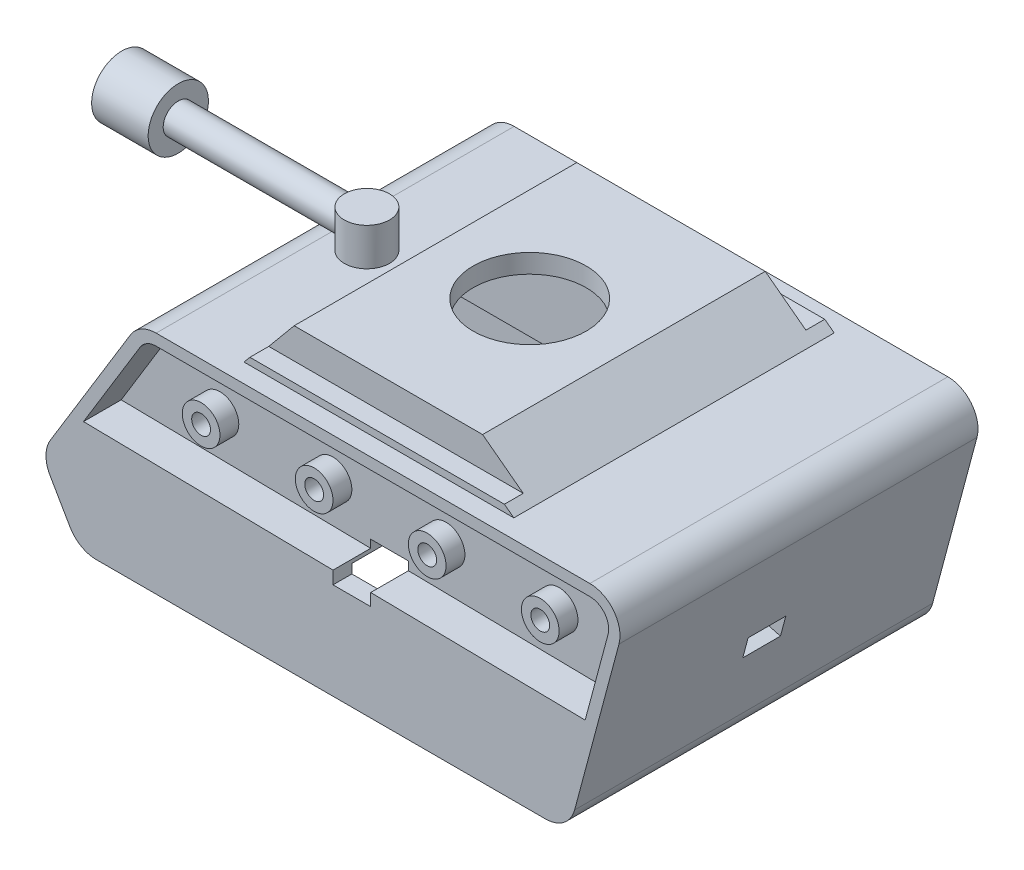
from build123d import *

# Parameters (mm, degrees)
SALIENTE_EXTRUIR2_DEPTH  = 75
CORTAR_EXTRUIR1_DEPTH    = 32.5
CROQUIS3_W               = 110
CROQUIS3_H               = 65
CORTAR_EXTRUIR2_DEPTH    = 55
CORTAR_EXTRUIR2_DRAFT    = -7
CROQUIS4_R               = 15
CORTAR_EXTRUIR3_DEPTH    = 55
CROQUIS5_R               = 5
CROQUIS5_R_2             = 2.5
SALIENTE_EXTRUIR3_DEPTH  = 5
CROQUIS5_3_R             = 5
CROQUIS5_3_R_2           = 2.5
SALIENTE_EXTRUIR4_DEPTH  = 5
SALIENTE_EXTRUIR5_START  = 5
CROQUIS6_R               = 5
CROQUIS6_R_2             = 2.500392092
CROQUIS6_R_3             = 2.5
SALIENTE_EXTRUIR5_DEPTH  = 5
SALIENTE_EXTRUIR6_DEPTH  = 10
SALIENTE_EXTRUIR7_START  = 10
SALIENTE_EXTRUIR7_DEPTH  = 10
CROQUIS9_R               = 6
SALIENTE_EXTRUIR8_DEPTH  = 10
CROQUIS10_R              = 4
SALIENTE_EXTRUIR9_DEPTH  = 50
CROQUIS11_R              = 8
CROQUIS11_R_2            = 4
SALIENTE_EXTRUIR10_DEPTH = 15
CROQUIS13_W              = 10
CROQUIS13_H              = 5.5
CORTAR_EXTRUIR4_DEPTH    = 150.747299501
CROQUIS14_W              = 10
CROQUIS14_H              = 5.5
CORTAR_EXTRUIR5_DEPTH    = 10
CROQUIS15_W              = 10
CROQUIS15_H              = 5.5
CORTAR_EXTRUIR6_DEPTH    = 10
CORTAR_EXTRUIR8_START    = -10
CORTAR_EXTRUIR8_DEPTH    = 10
CORTAR_EXTRUIR9_DEPTH    = 10


with BuildPart() as part:
    # Croquis1 → Saliente-Extruir2 (new body)
    with BuildSketch(Plane.XY):
        with BuildLine():
            ThreePointArc((75.985648559, 52.638141098), (82.331351573, 49.509696626), (83.714009708, 42.571154413))
            Line((83.714009708, 42.571154413), (71.94600193, -1.428845587))
            ThreePointArc((71.94600193, -1.428845587), (69.089196309, -5.707561916), (64.217640781, -7.361858902))
            Line((64.217640781, -7.361858902), (-55.022008345, -7.361858902))
            ThreePointArc((-55.022008345, -7.361858902), (-59.022008345, -6.290062133), (-61.950211576, -3.361858902))
            Line((-61.950211576, -3.361858902), (-67.265987011, 5.845334234))
            ThreePointArc((-67.265987011, 5.845334234), (-68.337190395, 9.94277051), (-67.166502489, 14.012899568))
            Line((-67.166502489, 14.012899568), (-45.932461091, 48.805706431))
            ThreePointArc((-45.932461091, 48.805706431), (-43.0190634, 51.614548578), (-39.103742383, 52.638141098))
            Line((-39.103742383, 52.638141098), (75.985648559, 52.638141098))
        make_face()
        Polygon((-12.478128479, 62.638141098), (-20.784752342, 52.638141098), (50.8195562, 52.638141098), (37.521871521, 62.638141098), align=None)
    extrude(amount=-SALIENTE_EXTRUIR2_DEPTH)

    # Croquis2 → Cortar-Extruir1 (cut, symmetric)
    with BuildSketch(Plane.XY.offset(-37.5)):
        with BuildLine():
            Line((75.985648559, 47.638141098), (49.149317794, 47.638141098))
            Line((49.149317794, 47.638141098), (35.851633115, 57.638141098))
            Line((35.851633115, 57.638141098), (-10.13144041, 57.638141098))
            Line((-10.13144041, 57.638141098), (-18.438064273, 47.638141098))
            Line((-18.438064273, 47.638141098), (-39.103742383, 47.638141098))
            ThreePointArc((-39.103742383, 47.638141098), (-40.571987765, 47.254293903), (-41.664511899, 46.200978098))
            Line((-41.664511899, 46.200978098), (-62.898553296, 11.408171234))
            ThreePointArc((-62.898553296, 11.408171234), (-63.337561261, 9.881872837), (-62.935859992, 8.345334234))
            Line((-62.935859992, 8.345334234), (-57.620084557, -0.861858902))
            ThreePointArc((-57.620084557, -0.861858902), (-56.522008345, -1.959935114), (-55.022008345, -2.361858902))
            Line((-55.022008345, -2.361858902), (64.217640781, -2.361858902))
            ThreePointArc((64.217640781, -2.361858902), (66.044474104, -1.741497532), (67.115776212, -0.136978909))
            Line((67.115776212, -0.136978909), (78.88378399, 43.863021091))
            ThreePointArc((78.88378399, 43.863021091), (78.365287189, 46.464974421), (75.985648559, 47.638141098))
        make_face()
    extrude(amount=CORTAR_EXTRUIR1_DEPTH, both=True, mode=Mode.SUBTRACT)


with BuildPart() as cortar_extruir2_tool:
    # Croquis3 → Cortar-Extruir2 (with draft: the straight prism first)
    with BuildSketch(Plane.XZ.offset(7.361858902)):
        with Locations((4.977991655, -37.5)):
            Rectangle(CROQUIS3_W, CROQUIS3_H)
    extrude(amount=-CORTAR_EXTRUIR2_DEPTH)
    # Cortar-Extruir2: the draft: its side faces are tilted about the plane it starts from
    cortar_extruir2_sides = [cortar_extruir2_tool.faces().sort_by_distance(p)[0] for p in [
        (-50.022008345, 20.138141098, -37.5),
        (4.977991655, 20.138141098, -70),
        (59.977991655, 20.138141098, -37.5),
        (4.977991655, 20.138141098, -5),
    ]]
    draft(cortar_extruir2_sides, Plane.XZ.offset(7.361858902), CORTAR_EXTRUIR2_DRAFT)


with BuildPart() as part_1:
    add(part.part)

    # Cortar-Extruir2: cut by cortar_extruir2_tool
    add(cortar_extruir2_tool.part, mode=Mode.SUBTRACT)

    # Croquis4 → Cortar-Extruir3 (cut)
    with BuildSketch(Plane(origin=(0, 62.638141098, 0), x_dir=(1, 0, 0), z_dir=(0, 1, 0))):
        with Locations(Location((12.521871521, 37.5, 0), (0, 0, 270))):
            Circle(CROQUIS4_R)
    extrude(amount=-CORTAR_EXTRUIR3_DEPTH, mode=Mode.SUBTRACT)

    # Croquis5 → Saliente-Extruir3 (add)
    # profile 1 of 4: a face of its own
    with BuildSketch(Plane.XY):
        with Locations((57.830005819, 32.638141098)):
            Circle(CROQUIS5_R)
        with Locations((57.830005819, 32.638141098)):
            Circle(CROQUIS5_R_2, mode=Mode.SUBTRACT)
    # profile 2 of 4: a face of its own
    with BuildSketch(Plane.XY):
        with Locations((27.830005819, 32.638141098)):
            Circle(CROQUIS5_R)
        with Locations((27.830005819, 32.638141098)):
            Circle(CROQUIS5_R_2, mode=Mode.SUBTRACT)
    # profile 3 of 4: a face of its own
    with BuildSketch(Plane.XY):
        with Locations((-2.169994181, 32.638141098)):
            Circle(CROQUIS5_R)
        with Locations((-2.169994181, 32.638141098)):
            Circle(CROQUIS5_R_2, mode=Mode.SUBTRACT)
    # profile 4 of 4: a face of its own
    with BuildSketch(Plane.XY):
        with Locations((-32.169994181, 32.638141098)):
            Circle(CROQUIS5_R)
        with Locations((-32.169994181, 32.638141098)):
            Circle(CROQUIS5_R_2, mode=Mode.SUBTRACT)
    extrude(amount=SALIENTE_EXTRUIR3_DEPTH)

    # Croquis5<3> → Saliente-Extruir4 (add)
    # profile 1 of 5: a face of its own
    with BuildSketch(Plane.XY):
        with Locations((57.830005819, 32.638141098)):
            Circle(CROQUIS5_3_R)
        with Locations((57.830005819, 32.638141098)):
            Circle(CROQUIS5_3_R_2, mode=Mode.SUBTRACT)
    # profile 2 of 5: a face of its own
    with BuildSketch(Plane.XY):
        with Locations((27.830005819, 32.638141098)):
            Circle(CROQUIS5_3_R)
        with Locations((27.830005819, 32.638141098)):
            Circle(CROQUIS5_3_R_2, mode=Mode.SUBTRACT)
    # profile 3 of 5: a face of its own
    with BuildSketch(Plane.XY):
        with Locations((-2.169994181, 32.638141098)):
            Circle(CROQUIS5_3_R)
        with Locations((-2.169994181, 32.638141098)):
            Circle(CROQUIS5_3_R_2, mode=Mode.SUBTRACT)
    # profile 4 of 5: a face of its own
    with BuildSketch(Plane.XY):
        with Locations((-32.169994181, 32.638141098)):
            Circle(CROQUIS5_3_R)
        with Locations((-32.169994181, 32.638141098)):
            Circle(CROQUIS5_3_R_2, mode=Mode.SUBTRACT)
    # profile 5 of 5: a face of its own
    with BuildSketch(Plane.XY):
        Polygon((-20.784752342, 52.638141098), (50.8195562, 52.638141098), (48.316992723, 54.520095391), (-19.221483697, 54.520095391), align=None)
    extrude(amount=SALIENTE_EXTRUIR4_DEPTH)

    # Croquis6 → Saliente-Extruir5 (add)
    # profile 1 of 5: a face of its own
    with BuildSketch(Plane(origin=(0, 0, -75), x_dir=(-1, 0, 0), z_dir=(0, 0, -1)).offset(SALIENTE_EXTRUIR5_START)):
        with Locations(Location((-57.830005819, 32.638141098, 0), (0, 0, 180))):
            Circle(CROQUIS6_R)
        with Locations((-57.830005819, 32.638141098)):
            Circle(CROQUIS6_R_2, mode=Mode.SUBTRACT)
    # profile 2 of 5: a face of its own
    with BuildSketch(Plane(origin=(0, 0, -75), x_dir=(-1, 0, 0), z_dir=(0, 0, -1)).offset(SALIENTE_EXTRUIR5_START)):
        with Locations(Location((-27.830005819, 32.638141098, 0), (0, 0, 180))):
            Circle(CROQUIS6_R)
        with Locations(Location((-27.830005819, 32.638141098, 0), (0, 0, 180))):
            Circle(CROQUIS6_R_3, mode=Mode.SUBTRACT)
    # profile 3 of 5: a face of its own
    with BuildSketch(Plane(origin=(0, 0, -75), x_dir=(-1, 0, 0), z_dir=(0, 0, -1)).offset(SALIENTE_EXTRUIR5_START)):
        with Locations(Location((2.169994181, 32.638141098, 0), (0, 0, 180))):
            Circle(CROQUIS6_R)
        with Locations(Location((2.169994181, 32.638141098, 0), (0, 0, 180))):
            Circle(CROQUIS6_R_3, mode=Mode.SUBTRACT)
    # profile 4 of 5: a face of its own
    with BuildSketch(Plane(origin=(0, 0, -75), x_dir=(-1, 0, 0), z_dir=(0, 0, -1)).offset(SALIENTE_EXTRUIR5_START)):
        with Locations(Location((32.169994181, 32.638141098, 0), (0, 0, 180))):
            Circle(CROQUIS6_R)
        with Locations(Location((32.169994181, 32.638141098, 0), (0, 0, 180))):
            Circle(CROQUIS6_R_3, mode=Mode.SUBTRACT)
    # profile 5 of 5: a face of its own
    with BuildSketch(Plane(origin=(0, 0, -75), x_dir=(-1, 0, 0), z_dir=(0, 0, -1)).offset(SALIENTE_EXTRUIR5_START)):
        Polygon((-50.8195562, 52.638141098), (20.784752342, 52.638141098), (19.221483697, 54.520095391), (-48.316992723, 54.520095391), align=None)
    extrude(amount=-SALIENTE_EXTRUIR5_DEPTH)

    # Croquis7 → Saliente-Extruir6 (add)
    with BuildSketch(Plane(origin=(0, 0, -75), x_dir=(-1, 0, 0), z_dir=(0, 0, -1))):
        with BuildLine():
            Line((-64.217640781, -7.361858902), (55.022008345, -7.361858902))
            ThreePointArc((55.022008345, -7.361858902), (59.022008345, -6.290062133), (61.950211576, -3.361858902))
            Line((61.950211576, -3.361858902), (67.265987011, 5.845334234))
            ThreePointArc((67.265987011, 5.845334234), (68.337190395, 9.94277051), (67.166502489, 14.012899568))
            Line((67.166502489, 14.012899568), (45.932461091, 48.805706431))
            ThreePointArc((45.932461091, 48.805706431), (43.0190634, 51.614548578), (39.103742383, 52.638141098))
            Line((39.103742383, 52.638141098), (-75.985648559, 52.638141098))
            ThreePointArc((-75.985648559, 52.638141098), (-82.331351573, 49.509696626), (-83.714009708, 42.571154413))
            Line((-83.714009708, 42.571154413), (-71.94600193, -1.428845587))
            ThreePointArc((-71.94600193, -1.428845587), (-69.089196309, -5.707561916), (-64.217640781, -7.361858902))
        make_face()
        with BuildLine():
            Line((-80.815874277, 43.34627442), (-75.750475658, 24.406999103))
            Line((-75.750475658, 24.406999103), (57.308417572, 24.406999103))
            Line((57.308417572, 24.406999103), (43.371691576, 47.242869431))
            ThreePointArc((43.371691576, 47.242869431), (41.550818019, 48.998395773), (39.103742383, 49.638141098))
            Line((39.103742383, 49.638141098), (-75.985648559, 49.638141098))
            ThreePointArc((-75.985648559, 49.638141098), (-79.951712943, 47.682863303), (-80.815874277, 43.34627442))
        make_face(mode=Mode.SUBTRACT)
    extrude(amount=SALIENTE_EXTRUIR6_DEPTH)

    # Croquis8 → Saliente-Extruir7 (add)
    with BuildSketch(Plane.XY.offset(SALIENTE_EXTRUIR7_START)):
        with BuildLine():
            Line((-67.265987011, 5.845334234), (-61.950211576, -3.361858902))
            ThreePointArc((-61.950211576, -3.361858902), (-59.022008345, -6.290062133), (-55.022008345, -7.361858902))
            Line((-55.022008345, -7.361858902), (64.217640781, -7.361858902))
            ThreePointArc((64.217640781, -7.361858902), (69.089196309, -5.707561916), (71.94600193, -1.428845587))
            Line((71.94600193, -1.428845587), (77.830005819, 20.571154413))
            Line((77.830005819, 20.571154413), (83.714009708, 42.571154413))
            ThreePointArc((83.714009708, 42.571154413), (82.331351573, 49.509696626), (75.985648559, 52.638141098))
            Line((75.985648559, 52.638141098), (-39.103742383, 52.638141098))
            ThreePointArc((-39.103742383, 52.638141098), (-43.0190634, 51.614548578), (-45.932461091, 48.805706431))
            Line((-45.932461091, 48.805706431), (-61.857992139, 22.711101283))
            Line((-61.857992139, 22.711101283), (-67.166502489, 14.012899568))
            ThreePointArc((-67.166502489, 14.012899568), (-68.337190395, 9.94277051), (-67.265987011, 5.845334234))
        make_face()
        with BuildLine():
            Line((74.737232796, 20.618534074), (-58.375978579, 22.657758662))
            Line((-58.375978579, 22.657758662), (-43.371691576, 47.242869431))
            ThreePointArc((-43.371691576, 47.242869431), (-41.550818019, 48.998395773), (-39.103742383, 49.638141098))
            Line((-39.103742383, 49.638141098), (75.985648559, 49.638141098))
            ThreePointArc((75.985648559, 49.638141098), (79.951712943, 47.682863303), (80.815874277, 43.34627442))
            Line((80.815874277, 43.34627442), (74.931870388, 21.34627442))
            Line((74.931870388, 21.34627442), (74.737232796, 20.618534074))
        make_face(mode=Mode.SUBTRACT)
    extrude(amount=-SALIENTE_EXTRUIR7_DEPTH)

    # Croquis9 → Saliente-Extruir8 (add)
    with BuildSketch(Plane(origin=(0, 52.638141098, 0), x_dir=(1, 0, 0), z_dir=(0, 1, 0))):
        with Locations(Location((-30.145674551, 36.966662757, 0), (0, 0, 90))):
            Circle(CROQUIS9_R)
    extrude(amount=SALIENTE_EXTRUIR8_DEPTH)

    # Croquis10 → Saliente-Extruir9 (add)
    with BuildSketch(Plane(origin=(-30, 0, 0), x_dir=(0, 0, -1), z_dir=(1, 0, 0))):
        with Locations((36.77409929, 58.138141098)):
            Circle(CROQUIS10_R)
    extrude(amount=-SALIENTE_EXTRUIR9_DEPTH)

    # Croquis13 → Cortar-Extruir4 (cut, through all)
    with BuildSketch(Plane(origin=(0, 0, -85), x_dir=(-1, 0, 0), z_dir=(0, 0, -1))):
        with Locations((-12.830005819, 20.998141098)):
            Rectangle(CROQUIS13_W, CROQUIS13_H)
    extrude(amount=-CORTAR_EXTRUIR4_DEPTH, mode=Mode.SUBTRACT)

    # Croquis14 → Cortar-Extruir5 (cut)
    with BuildSketch(Plane(origin=(67.499758765, -18.053129231, 0), x_dir=(0, 0, -1), z_dir=(0.9660451436025732, -0.25837333554738934, 0))):
        with Locations((35, 37.830238009)):
            Rectangle(CROQUIS14_W, CROQUIS14_H)
    extrude(amount=-CORTAR_EXTRUIR5_DEPTH, mode=Mode.SUBTRACT)

    # Croquis15 → Cortar-Extruir6 (cut)
    with BuildSketch(Plane(origin=(-55.169733428, 33.670074625, 0), x_dir=(0, 0, 1), z_dir=(-0.8535898384862245, 0.5209456666803759, 0))):
        with Locations((-40, -15.018261496)):
            Rectangle(CROQUIS15_W, CROQUIS15_H)
    extrude(amount=-CORTAR_EXTRUIR6_DEPTH, mode=Mode.SUBTRACT)

    # Croquis16 → Cortar-Extruir8 (cut)
    with BuildSketch(Plane(origin=(0, 0, -5), x_dir=(-1, 0, 0), z_dir=(0, 0, -1)).offset(CORTAR_EXTRUIR8_START)):
        with BuildLine():
            Line((62.898553296, 11.408171234), (56.601326318, 21.726423795))
            Line((56.601326318, 21.726423795), (-7.830005819, 20.658584157))
            Line((-7.830005819, 20.658584157), (-7.830005819, 18.248141098))
            Line((-7.830005819, 18.248141098), (-17.830005819, 18.248141098))
            Line((-17.830005819, 18.248141098), (-17.830005819, 20.492851181))
            Line((-17.830005819, 20.492851181), (-72.391472167, 19.588587765))
            Line((-72.391472167, 19.588587765), (-67.115776212, -0.136978909))
            ThreePointArc((-67.115776212, -0.136978909), (-66.044474104, -1.741497532), (-64.217640781, -2.361858902))
            Line((-64.217640781, -2.361858902), (55.022008345, -2.361858902))
            ThreePointArc((55.022008345, -2.361858902), (56.522008345, -1.959935114), (57.620084557, -0.861858902))
            Line((57.620084557, -0.861858902), (62.935859992, 8.345334234))
            ThreePointArc((62.935859992, 8.345334234), (63.337561261, 9.881872837), (62.898553296, 11.408171234))
        make_face()
    extrude(amount=CORTAR_EXTRUIR8_DEPTH, mode=Mode.SUBTRACT)

    # Croquis18 → Cortar-Extruir9 (cut)
    with BuildSketch(Plane.XY.offset(-70)):
        with BuildLine():
            Line((-64.605732973, 12.450062567), (-59.139316828, 21.406999103))
            Line((-59.139316828, 21.406999103), (-57.308417572, 21.406999103))
            Line((-57.308417572, 21.406999103), (74.948111491, 21.406999103))
            Line((74.948111491, 21.406999103), (69.047866499, -0.65372558))
            ThreePointArc((69.047866499, -0.65372558), (67.262362986, -3.327923286), (64.217640781, -4.361858902))
            Line((64.217640781, -4.361858902), (-55.022008345, -4.361858902))
            ThreePointArc((-55.022008345, -4.361858902), (-57.522008345, -3.691985921), (-59.352135364, -1.861858902))
            Line((-59.352135364, -1.861858902), (-64.6679108, 7.345334234))
            ThreePointArc((-64.6679108, 7.345334234), (-65.337412915, 9.906231906), (-64.605732973, 12.450062567))
        make_face()
    extrude(amount=-CORTAR_EXTRUIR9_DEPTH, mode=Mode.SUBTRACT)


with BuildPart() as body_2:
    # Croquis11 → Saliente-Extruir10 (new body)
    with BuildSketch(Plane.ZY.offset(80)):
        with Locations((-36.77409929, 58.138141098)):
            Circle(CROQUIS11_R)
        with Locations((-36.77409929, 58.138141098)):
            Circle(CROQUIS11_R_2, mode=Mode.SUBTRACT)
    extrude(amount=SALIENTE_EXTRUIR10_DEPTH)


solid = Compound([part_1.part, body_2.part])
